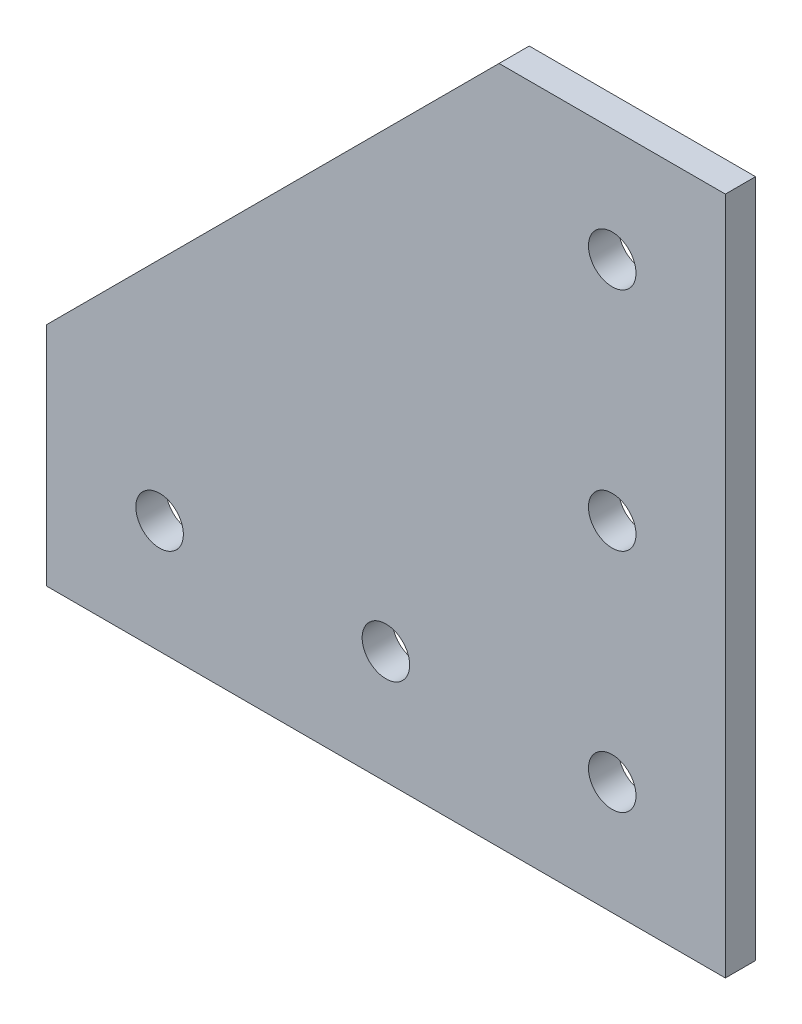
from build123d import *

# Parameters (mm, degrees)
SKETCH1_R      = 3.15
EXTRUDE1_DEPTH = 4


with BuildPart() as part:
    # Sketch1 → Extrude1 (new body)
    with BuildSketch(Plane.XY):
        Polygon((14.015385947, 97.315723434), (-15.984614053, 97.315723434), (-75.984614053, 37.315723434), (-75.984614053, 7.315723434), (14.015385947, 7.315723434), align=None)
        with Locations((-0.984614053, 52.315723434)):
            Circle(SKETCH1_R, mode=Mode.SUBTRACT)
        with Locations((-0.984614053, 82.315723434)):
            Circle(SKETCH1_R, mode=Mode.SUBTRACT)
        with Locations((-0.984614053, 22.315723434)):
            Circle(SKETCH1_R, mode=Mode.SUBTRACT)
        with Locations((-30.984614053, 22.315723434)):
            Circle(SKETCH1_R, mode=Mode.SUBTRACT)
        with Locations((-60.984614053, 22.315723434)):
            Circle(SKETCH1_R, mode=Mode.SUBTRACT)
    extrude(amount=EXTRUDE1_DEPTH)


solid = part.part
